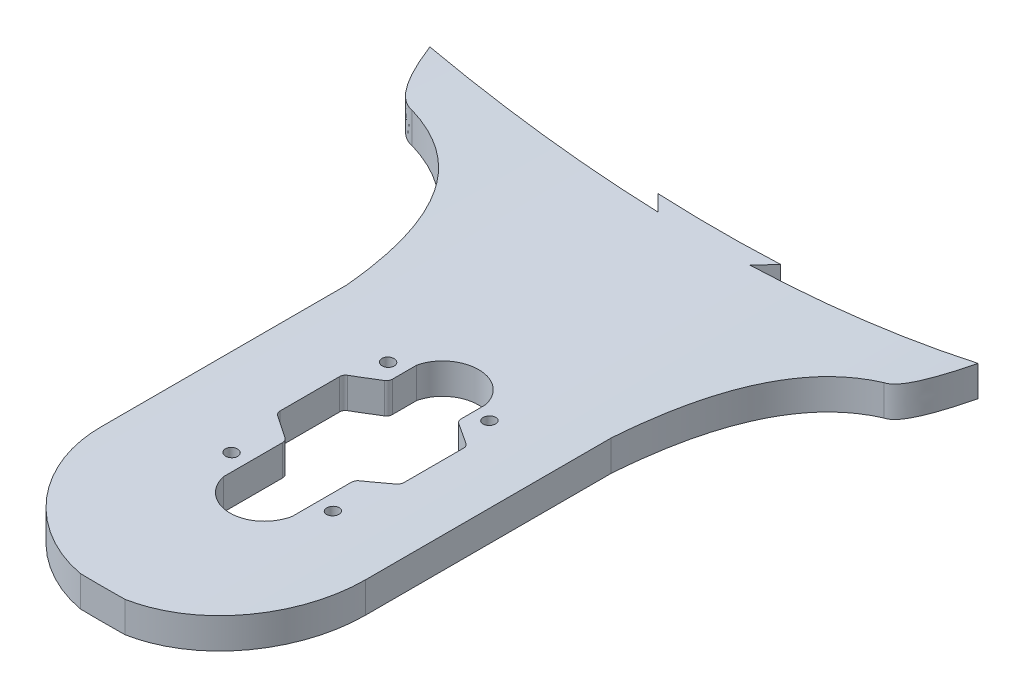
from build123d import *

# Parameters (mm, degrees)
BOSS_EXTRUDE1_DEPTH = 482.59999999999997
BOSS_EXTRUDE2_START = 98.425
BOSS_EXTRUDE2_DEPTH = 98.425
BOSS_EXTRUDE3_START = 254
BOSS_EXTRUDE3_DEPTH = 254
BOSS_EXTRUDE4_DEPTH = 254
BOSS_EXTRUDE5_DEPTH = 98.425
CUT_EXTRUDE1_DEPTH  = 98.425
SKETCH8_R           = 2.5399999999999943
SKETCH8_R_2         = 2.539999999999985
SKETCH8_R_3         = 2.5399999999999983
SKETCH8_R_4         = 2.539999999999981
SKETCH8_R_5         = 2.539999999999982
SKETCH8_R_6         = 2.539999999999969
CUT_EXTRUDE2_DEPTH  = 30.480000000000004
FILLET2_R           = 2.54
FILLET1_R           = 7.62
SKETCH9_R           = 6.349999999999994
SKETCH9_R_2         = 6.35000000000001
CUT_EXTRUDE3_DEPTH  = 38.1
CUT_EXTRUDE5_DEPTH  = 38.1


with BuildPart() as part:
    # Sketch1 → Boss-Extrude1 (new body)
    with BuildSketch(Plane.XY):
        with BuildLine():
            ThreePointArc((230.18750000000014, -12.7), (115.09375000000016, -25.399999708217024), (1.3303e-13, -12.7))
            Line((1.3303e-13, -12.7), (0, 0))
            ThreePointArc((0, 0), (115.09375000000003, -12.699999708216978), (230.1875, 0))
            Line((230.1875, 0), (230.18750000000014, -12.7))
        make_face()
    extrude(amount=BOSS_EXTRUDE1_DEPTH)

    # Sketch2 → Boss-Extrude2 (add)
    with BuildSketch(Plane(origin=(0, 0, 0), x_dir=(-1, 0, 0), z_dir=(0, 0, -1)).offset(BOSS_EXTRUDE2_START)):
        with BuildLine():
            ThreePointArc((-169.86250000000015, -9.851059053133781), (-200.16770645953937, -5.799422082207116), (-230.1875, 0))
            Line((-230.1875, 0), (-230.18750000000014, -12.7))
            ThreePointArc((-230.18750000000014, -12.700000000000045), (-200.16770645953937, -18.499422082206934), (-169.86250000000013, -22.551059053133486))
            Line((-169.86250000000015, -22.551059053133592), (-169.86250000000015, -19.049999708216802))
            Line((-169.86250000000015, -19.049999708216802), (-169.86250000000015, -9.85105905313366))
        make_face()
        with BuildLine():
            ThreePointArc((0, 0), (-30.01979354046084, -5.799422082207116), (-60.32500000000019, -9.851059053133781))
            Line((-60.325000000000166, -9.85105905313366), (-60.325000000000166, -19.049999708216802))
            Line((-60.325000000000166, -19.049999708216802), (-60.325000000000166, -22.551059053133592))
            ThreePointArc((-60.32500000000017, -22.551059053133486), (-30.01979354046088, -18.499422082207047), (-5.684e-14, -12.700000000000045))
            Line((-1.3303e-13, -12.7), (0, 0))
        make_face()
    extrude(amount=-BOSS_EXTRUDE2_DEPTH)

    # Sketch3 → Boss-Extrude3 (add)
    with BuildSketch(Plane(origin=(0, 0, 0), x_dir=(-1, 0, 0), z_dir=(0, 0, -1)).offset(BOSS_EXTRUDE3_START)):
        with BuildLine():
            Line((-169.86250000000015, -9.85105905313377), (-169.86250000000015, -22.551059053133816))
            ThreePointArc((-169.86250000000015, -22.551059053133816), (-115.0937500000001, -25.399999708217024), (-60.325000000000166, -22.551059053133816))
            Line((-60.325000000000166, -22.551059053133816), (-60.325000000000166, -9.85105905313377))
            ThreePointArc((-60.325000000000166, -9.85105905313377), (-115.0937500000002, -12.699999708216978), (-169.86250000000015, -9.85105905313377))
        make_face()
    extrude(amount=-BOSS_EXTRUDE3_DEPTH)

    # Sketch4 → Boss-Extrude4 (add)
    with BuildSketch(Plane.XY.offset(482.59999999999997)):
        with BuildLine():
            ThreePointArc((169.8625, -9.851059053133667), (115.09375, -12.699999708216865), (60.32500000000002, -9.851059053133554))
            Line((60.324999999999974, -9.85105905313366), (60.32499999999996, -22.551059053133816))
            ThreePointArc((60.32499999999997, -22.55105905313377), (115.09375, -25.399999708216967), (169.86250000000004, -22.551059053133883))
            Line((169.86249999999998, -22.551059053133816), (169.86249999999998, -9.85105905313377))
        make_face()
    extrude(amount=BOSS_EXTRUDE4_DEPTH)

    # Sketch5 → Boss-Extrude5 (add)
    with BuildSketch(Plane.XY.offset(482.59999999999997)):
        with BuildLine():
            Line((0, 0), (1.3303e-13, -12.7))
            ThreePointArc((1.3303e-13, -12.7), (115.09375000000016, -25.399999708216967), (230.18750000000014, -12.7))
            Line((230.18750000000014, -12.7), (230.1875, 0))
            ThreePointArc((230.1875, 0), (115.09375000000003, -12.699999708216865), (0, 0))
        make_face()
    extrude(amount=BOSS_EXTRUDE5_DEPTH)

    # Sketch6 → Cut-Extrude1 (cut)
    with BuildSketch(Plane(origin=(0, 0, 0), x_dir=(-1, 0, 0), z_dir=(0, -1, 0))):
        with BuildLine():
            Line((-60.324999999999974, -736.5999999999999), (-60.32499999999997, -682.625))
            ThreePointArc((-60.32499999999994, -682.625), (-73.2102757559419, -717.915091552868), (-105.80314444586806, -736.6000000000001))
            Line((-105.80314444586807, -736.5999999999999), (-60.324999999999974, -736.5999999999999))
        make_face()
        with BuildLine():
            Line((-169.86249999999998, -736.5999999999999), (-124.38435555413189, -736.5999999999999))
            ThreePointArc((-124.3843555541319, -736.6000000000001), (-156.97722424405805, -717.915091552868), (-169.8625, -682.625))
            Line((-169.86249999999998, -682.625), (-169.86249999999998, -736.5999999999999))
        make_face()
        with BuildLine():
            add(Edge.make_bspline(
                [(-169.86249999999998, -581.025), (-175.13876451622016, -517.0259135470571), (-212.83209325396822, -510.9167162698411)],
                knots=[0, 0, 0, 0.8257211002132265, 0.8257211002132265, 0.8257211002132265], degree=2))
            add(Edge.make_bspline(
                [(-212.83209325396822, -510.9167162698411), (-221.5097966268928, -510.9167162698411), (-230.18749999999994, -482.5999999999999)],
                knots=[0, 0, 0, 1, 1, 1], degree=2))
            Line((-230.18749999999994, -482.5999999999999), (-230.18750000000043, -510.9167162698411))
            Line((-230.18750000000043, -510.9167162698411), (-230.1875, -581.025))
            Line((-230.1875, -581.025), (-169.86249999999998, -581.025))
        make_face()
        with BuildLine():
            add(Edge.make_bspline(
                [(-17.35540674603169, -510.9167162698411), (-8.677703373107125, -510.9167162698411), (1.398e-14, -482.5999999999999)],
                knots=[0, 0, 0, 1, 1, 1], degree=2))
            Line((1.398e-14, -482.5999999999999), (1.195e-14, -510.9167162698411))
            Line((1.195e-14, -510.9167162698411), (0, -581.025))
            Line((0, -581.025), (-60.32499999999996, -581.025))
            add(Edge.make_bspline(
                [(-60.32499999999996, -581.025), (-55.048735482398115, -517.0259135470335), (-17.35540674603169, -510.9167162698411)],
                knots=[0, 0, 0, 0.825721100213823, 0.825721100213823, 0.825721100213823], degree=2))
        make_face()
        with BuildLine():
            add(Edge.make_bspline(
                [(-60.32500000000019, 98.42499999999998), (-55.04873548239812, 34.42591354703347), (-17.355406746031782, 28.316716269841223)],
                knots=[0, 0, 0, 0.8257211002138217, 0.8257211002138217, 0.8257211002138217], degree=2))
            add(Edge.make_bspline(
                [(-17.355406746031782, 28.316716269841223), (-8.677703373107148, 28.316716269841248), (0, 0)],
                knots=[0, 0, 0, 1, 1, 1], degree=2))
            Line((0, 0), (9.714e-14, 98.425))
            Line((9.714e-14, 98.425), (-60.32500000000019, 98.42499999999998))
        make_face()
        with BuildLine():
            add(Edge.make_bspline(
                [(-212.83209325396822, 28.31671626984129), (-221.5097966268928, 28.316716269841248), (-230.18749999999994, 0)],
                knots=[0, 0, 0, 1, 1, 1], degree=2))
            Line((-230.18749999999994, 0), (-230.1875, 98.425))
            Line((-230.1875, 98.425), (-169.86250000000015, 98.425))
            add(Edge.make_bspline(
                [(-169.86250000000015, 98.425), (-175.1387645162212, 34.4259135470572), (-212.83209325396822, 28.31671626984129)],
                knots=[0, 0, 0, 0.8257211002132272, 0.8257211002132272, 0.8257211002132272], degree=2))
        make_face()
        with BuildLine():
            Line((-169.86250000000015, 254), (-169.86250000000015, 200.02499999999998))
            ThreePointArc((-169.86250000000015, 200.02499999999998), (-156.9772242440584, 235.315091552868), (-124.38435555413241, 254.00000000000023))
            Line((-124.3843555541324, 254), (-169.86250000000015, 254))
        make_face()
        with BuildLine():
            Line((-60.32500000000019, 254), (-105.80314444586791, 254))
            ThreePointArc((-105.8031444458679, 254.0000000000002), (-73.21027575594192, 235.315091552868), (-60.32500000000019, 200.02499999999998))
            Line((-60.32500000000019, 200.02499999999998), (-60.32500000000019, 254))
        make_face()
    extrude(amount=CUT_EXTRUDE1_DEPTH, mode=Mode.SUBTRACT)

    # Sketch8 → Cut-Extrude2 (cut)
    with BuildSketch(Plane(origin=(0, 0, 0), x_dir=(-1, 0, 0), z_dir=(0, -1, 0))):
        with BuildLine():
            ThreePointArc((-100.86975371724569, 109.85500081941541), (-115.09375000000001, 98.42499999999991), (-129.31774628275423, 109.8550008194154))
            Line((-129.31774628275423, 109.8550008194154), (-129.31774628275423, 121.28499999999998))
            Line((-129.31774628275423, 121.28499999999998), (-140.7477462827542, 128.90499999999997))
            Line((-140.7477462827542, 128.90499999999997), (-140.7477462827542, 156.337))
            Line((-140.7477462827542, 156.337), (-129.31774628275423, 163.95699999999997))
            Line((-129.31774628275423, 163.95699999999997), (-129.31774628275423, 189.86500081941537))
            ThreePointArc((-129.31774628275423, 189.86500081941537), (-115.09375000000001, 201.29499584735922), (-100.86975371724574, 189.86500081941537))
            Line((-100.86975371724574, 189.86500081941537), (-100.86975371724574, 163.95699999999994))
            Line((-100.86975371724574, 163.95699999999994), (-89.43975371724572, 156.33699999999996))
            Line((-89.43975371724572, 156.33699999999996), (-89.43975371724572, 128.90499999999997))
            Line((-89.43975371724572, 128.90499999999997), (-100.8697537172457, 121.28499999999998))
            Line((-100.8697537172457, 121.28499999999998), (-100.86975371724569, 109.85500081941541))
        make_face()
        with Locations(Location((-94.13875000000002, 114.93499999999999, 0), (0, 0, 270))):
            Circle(SKETCH8_R)
        with BuildLine():
            ThreePointArc((-100.86975371724569, -672.4650008194153), (-115.09374999999996, -683.8949958473592), (-129.31774628275411, -672.4650008194153))
            Line((-129.31774628275411, -672.4650008194153), (-129.31774628275411, -646.5569999999998))
            Line((-129.31774628275411, -646.5569999999998), (-140.7477462827541, -638.9369999999999))
            Line((-140.7477462827541, -638.9369999999999), (-140.7477462827541, -611.5049999999999))
            Line((-140.7477462827541, -611.5049999999999), (-129.31774628275411, -603.8849999999999))
            Line((-129.31774628275411, -603.8849999999999), (-129.31774628275411, -592.4550008194154))
            ThreePointArc((-129.31774628275411, -592.4550008194154), (-115.09374999999994, -581.0249999999999), (-100.86975371724563, -592.4550008194154))
            Line((-100.86975371724563, -592.4550008194154), (-100.86975371724564, -603.8849999999999))
            Line((-100.86975371724564, -603.8849999999999), (-89.43975371724567, -611.5049999999999))
            Line((-89.43975371724567, -611.5049999999999), (-89.43975371724567, -638.9369999999999))
            Line((-89.43975371724567, -638.9369999999999), (-100.86975371724569, -646.5569999999998))
            Line((-100.86975371724569, -646.5569999999998), (-100.86975371724569, -672.4650008194153))
        make_face()
        with Locations(Location((-136.04875, 179.70499999999998, 0), (0, 0, 270))):
            Circle(SKETCH8_R_2)
        with Locations(Location((-94.13875000000002, 179.70499999999998, 0), (0, 0, 270))):
            Circle(SKETCH8_R_3)
        with Locations(Location((-136.04875, 114.93499999999999, 0), (0, 0, 270))):
            Circle(SKETCH8_R_4)
        with Locations(Location((-94.13874999999996, -662.305, 0), (0, 0, 270))):
            Circle(SKETCH8_R_5)
        with Locations(Location((-136.0487499999999, -662.305, 0), (0, 0, 270))):
            Circle(SKETCH8_R_6)
        with Locations(Location((-94.13874999999996, -597.535, 0), (0, 0, 270))):
            Circle(SKETCH8_R_5)
        with Locations(Location((-136.0487499999999, -597.535, 0), (0, 0, 270))):
            Circle(SKETCH8_R_6)
    extrude(amount=CUT_EXTRUDE2_DEPTH, mode=Mode.SUBTRACT)

    # Fillet2
    fillet2_edges = [part.edges().sort_by_distance(p)[0] for p in [
        (100.8697537172457, -18.858324334332178, -121.28499999999998),
        (89.43975371724572, -18.426249184171922, -128.90499999999997),
        (89.43975371724572, -18.426249184171922, -156.33699999999996),
        (100.86975371724574, -18.85832433433218, -163.95699999999994),
        (129.31774628275423, -18.858324334332185, -121.28499999999998),
        (140.7477462827542, -18.426249184171933, -128.90499999999997),
        (140.7477462827542, -18.426249184171933, -156.337),
        (129.31774628275423, -18.858324334332185, -163.95699999999997),
        (140.7477462827541, -18.426249184171937, 638.9369999999999),
        (140.7477462827541, -18.426249184171937, 611.5049999999999),
        (89.43975371724567, -18.426249184171922, 638.9369999999999),
        (89.43975371724567, -18.426249184171922, 611.5049999999999),
        (129.31774628275411, -18.858324334332185, 646.5569999999998),
        (129.31774628275411, -18.858324334332185, 603.8849999999999),
        (100.86975371724569, -18.858324334332178, 646.5569999999998),
        (100.86975371724564, -18.858324334332174, 603.8849999999999),
    ]]
    fillet(fillet2_edges, radius=FILLET2_R)

    # Fillet1
    fillet1_edges = [part.edges().sort_by_distance(p)[0] for p in [
        (0, -6.350000000000027, 0),
        (-1.398e-14, -6.350000000000038, 482.5999999999999),
        (230.18749999999994, -6.350000000000027, 0),
        (230.18749999999994, -6.350000000000038, 482.5999999999999),
    ]]
    fillet(fillet1_edges, radius=FILLET1_R)

    # Sketch9 → Cut-Extrude3 (cut)
    with BuildSketch(Plane(origin=(0, 0, 0), x_dir=(-1, 0, 0), z_dir=(0, -1, 0))):
        with Locations(Location((-115.0937500000001, -444.6177007658428, 0), (0, 0, 270))):
            Circle(SKETCH9_R)
        with Locations(Location((-115.09375000000011, -374.76770076584285, 0), (0, 0, 270))):
            Circle(SKETCH9_R)
        with Locations(Location((-115.09375000000004, -107.83229923415722, 0), (0, 0, 270))):
            Circle(SKETCH9_R_2)
        with Locations(Location((-115.09375, -37.982299234157246, 0), (0, 0, 270))):
            Circle(SKETCH9_R_2)
    extrude(amount=CUT_EXTRUDE3_DEPTH, mode=Mode.SUBTRACT)

    # Sketch10 → Cut-Extrude5 (cut)
    with BuildSketch(Plane(origin=(0, 0, 0), x_dir=(-1, 0, 0), z_dir=(0, -1, 0))):
        Polygon((-237.29590017952518, 5.197700765381952), (-237.29590017952518, -487.7977007658429), (-228.51396941832957, -487.7977007658429), (-134.143749999528, -487.7977007653709), (-140.49374999999998, -481.44770076584274), (-89.69374999999995, -481.44770076584285), (-96.04374999997343, -487.79770076586937), (-1.6735305817691115, -487.7977007658429), (6.57931547318924, -487.7977007658429), (6.57931547318924, 5.197700765381952), (-1.6735305817690513, 5.19770076584275), (-96.0437500000011, 5.197700765841473), (-89.69374999999984, -1.1522992341572724), (-140.4937499999998, -1.152299234157328), (-134.143749999539, 5.197700765381952), (-228.51396941832942, 5.197700765381952), align=None)
        Polygon((-228.51396941832942, 264.7544501688941), (-228.51396941832942, 5.197700765381952), (-134.143749999539, 5.197700765381952), (-96.0437500000011, 5.197700765381952), (-1.6735305817690573, 5.19770076584275), (-1.6735305817690513, 264.7544501688941), align=None)
        Polygon((-96.0437500000011, 5.197700765381952), (-134.143749999539, 5.197700765381952), (-140.4937499999998, -1.1522992341573284), (-89.69374999999984, -1.1522992341572724), align=None)
    extrude(amount=CUT_EXTRUDE5_DEPTH, mode=Mode.SUBTRACT)


solid = part.part
